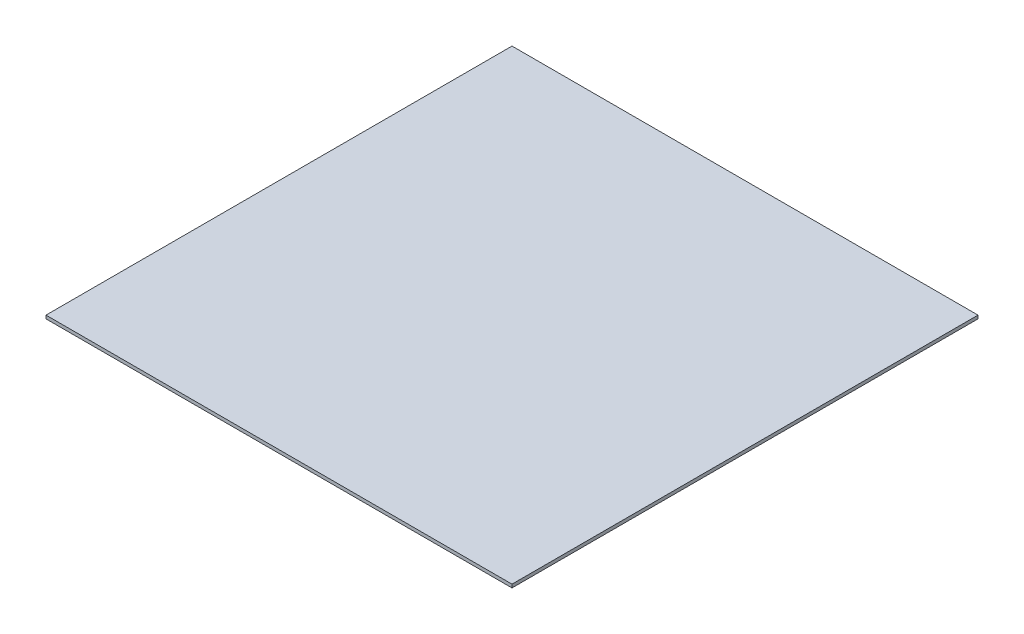
from build123d import *

# Parameters (mm, degrees)
SKETCH1_W           = 450
SKETCH1_H           = 450
BOSS_EXTRUDE1_DEPTH = 3.175


with BuildPart() as part:
    # Sketch1 → Boss-Extrude1 (new body)
    with BuildSketch(Plane(origin=(0, 0, 0), x_dir=(1, 0, 0), z_dir=(0, 1, 0))):
        with Locations((225, 225)):
            Rectangle(SKETCH1_W, SKETCH1_H)
    extrude(amount=BOSS_EXTRUDE1_DEPTH)


solid = part.part
